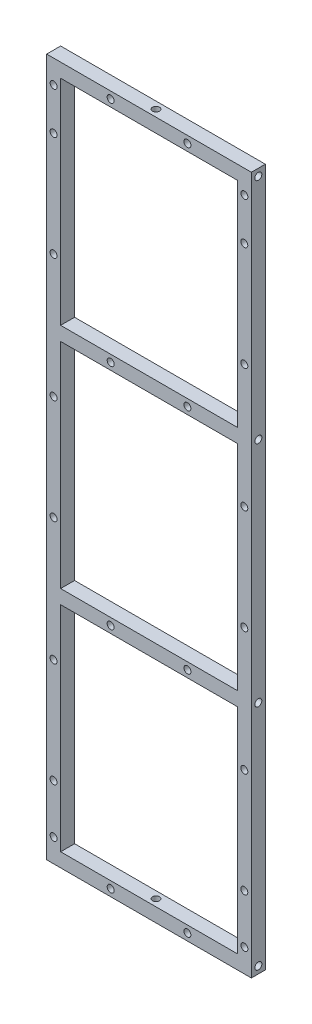
from build123d import *

# Parameters (mm, degrees)
SKETCH1_W           = 88
SKETCH1_H           = 300
SKETCH1_W_2         = 76
SKETCH1_H_2         = 92
BOSS_EXTRUDE1_DEPTH = 6
SKETCH2_R           = 1.5
CUT_EXTRUDE1_DEPTH  = 10
SKETCH3_R           = 1.5
CUT_EXTRUDE2_DEPTH  = 10
SKETCH4_R           = 1.5
CUT_EXTRUDE3_DEPTH  = 10
SKETCH5_R           = 1.5
CUT_EXTRUDE4_DEPTH  = 10


with BuildPart() as part:
    # Sketch1 → Boss-Extrude1 (new body)
    with BuildSketch(Plane.XY):
        Rectangle(SKETCH1_W, SKETCH1_H)
        with Locations((0, 98)):
            Rectangle(SKETCH1_W_2, SKETCH1_H_2, mode=Mode.SUBTRACT)
        with Locations((0, -98)):
            Rectangle(SKETCH1_W_2, SKETCH1_H_2, mode=Mode.SUBTRACT)
        Rectangle(SKETCH1_W_2, SKETCH1_H_2, mode=Mode.SUBTRACT)
    extrude(amount=BOSS_EXTRUDE1_DEPTH)

    # Sketch2 → Cut-Extrude1 (cut)
    with BuildSketch(Plane(origin=(44, 0, 0), x_dir=(0, 0, -1), z_dir=(1, 0, 0))):
        with Locations((-3, 147)):
            Circle(SKETCH2_R)
        with Locations((-3, 49)):
            Circle(SKETCH2_R)
        with Locations((-3, -49)):
            Circle(SKETCH2_R)
        with Locations((-3, -147)):
            Circle(SKETCH2_R)
    cut_extrude1 = extrude(amount=-CUT_EXTRUDE1_DEPTH, mode=Mode.SUBTRACT)

    # Mirror1: Cut-Extrude1 across plane
    add(cut_extrude1.mirror(Plane(origin=(0, 0, 0), x_dir=(0, 0, 1), z_dir=(1, 0, 0))), mode=Mode.SUBTRACT)

    # Sketch3 → Cut-Extrude2 (cut)
    with BuildSketch(Plane.XY.offset(6)):
        with Locations((-41, 140)):
            Circle(SKETCH3_R)
        with Locations((41, 140)):
            Circle(SKETCH3_R)
        with Locations((41, -140)):
            Circle(SKETCH3_R)
        with Locations((-41, -140)):
            Circle(SKETCH3_R)
    extrude(amount=-CUT_EXTRUDE2_DEPTH, mode=Mode.SUBTRACT)

    # Sketch4 → Cut-Extrude3 (cut)
    with BuildSketch(Plane.XY.offset(6)):
        with Locations((-16.5, 147)):
            Circle(SKETCH4_R)
        with Locations((16.5, 147)):
            Circle(SKETCH4_R)
        with Locations((16.5, 49)):
            Circle(SKETCH4_R)
        with Locations((-16.5, 49)):
            Circle(SKETCH4_R)
        with Locations((16.5, -49)):
            Circle(SKETCH4_R)
        with Locations((-16.5, -49)):
            Circle(SKETCH4_R)
        with Locations((16.5, -147)):
            Circle(SKETCH4_R)
        with Locations((-16.5, -147)):
            Circle(SKETCH4_R)
        with Locations((-41.040928423, 122)):
            Circle(SKETCH4_R)
        with Locations((-41.040928423, 77)):
            Circle(SKETCH4_R)
        with Locations((40.959071577, 122)):
            Circle(SKETCH4_R)
        with Locations((40.959071577, 77)):
            Circle(SKETCH4_R)
        with Locations((40.959071577, 24)):
            Circle(SKETCH4_R)
        with Locations((40.959071577, -21)):
            Circle(SKETCH4_R)
        with Locations((40.959071577, -74)):
            Circle(SKETCH4_R)
        with Locations((40.959071577, -119)):
            Circle(SKETCH4_R)
        with Locations((-41.040928423, 24)):
            Circle(SKETCH4_R)
        with Locations((-41.040928423, -21)):
            Circle(SKETCH4_R)
        with Locations((-41.040928423, -74)):
            Circle(SKETCH4_R)
        with Locations((-41.040928423, -119)):
            Circle(SKETCH4_R)
    extrude(amount=-CUT_EXTRUDE3_DEPTH, mode=Mode.SUBTRACT)

    # Sketch5 → Cut-Extrude4 (cut)
    with BuildSketch(Plane(origin=(0, 150, 0), x_dir=(1, 0, 0), z_dir=(0, 1, 0))):
        with Locations(Location((0, -3, 0), (0, 0, 270))):
            Circle(SKETCH5_R)
    cut_extrude4 = extrude(amount=-CUT_EXTRUDE4_DEPTH, mode=Mode.SUBTRACT)

    # Mirror2: Cut-Extrude4 across plane
    add(cut_extrude4.mirror(Plane.ZX), mode=Mode.SUBTRACT)


solid = part.part
